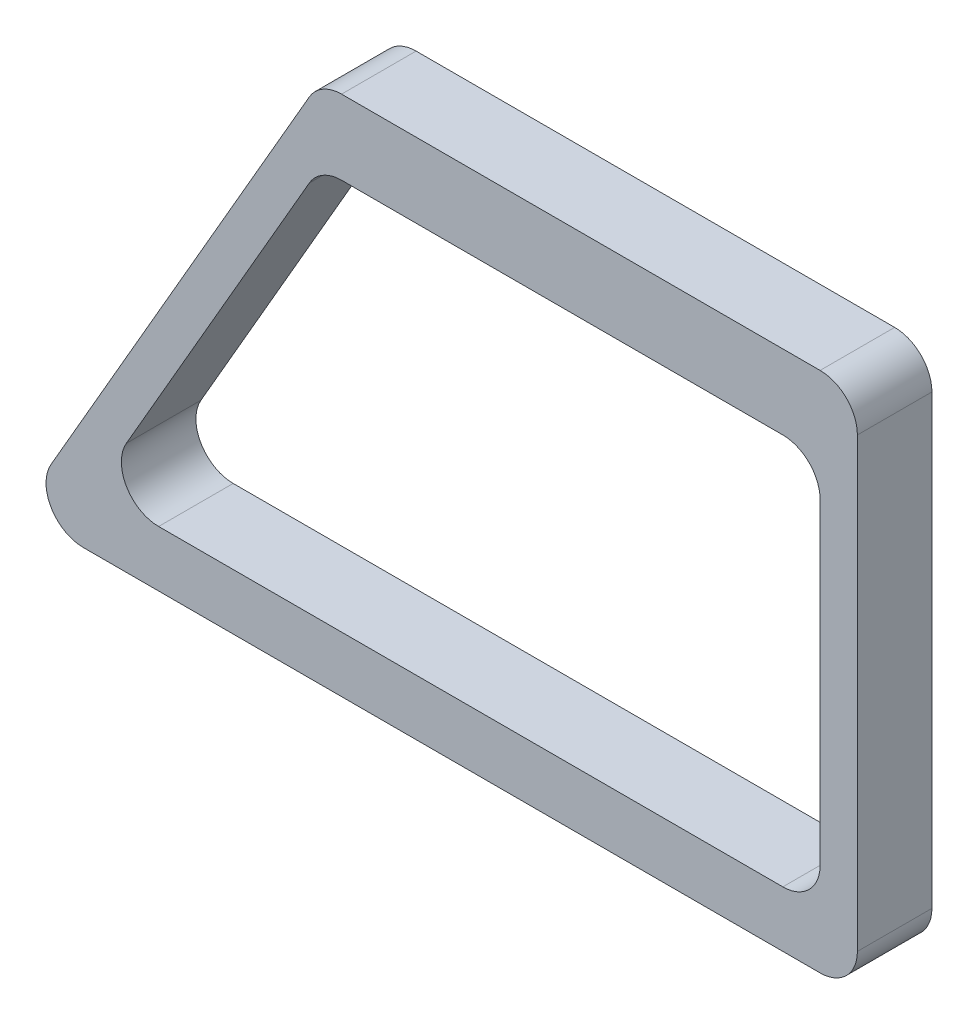
from build123d import *

# Parameters (mm, degrees)
BOSS_EXTRUDE1_DEPTH = 40
SKETCH3_R           = 2.5
CUT_EXTRUDE1_DEPTH  = 10
FILLET3_R           = 20


with BuildPart() as part:
    # Sketch1 → Boss-Extrude1 (new body)
    with BuildSketch(Plane.XY):
        Polygon((125.008360384, 233.626853351), (-36.649714989, -46.373146649), (413.350285011, -46.373146649), (413.350285011, 233.626853351), align=None)
        Polygon((393.350285011, 193.626853351), (393.350285011, -16.373146649), (3.764803854, -16.373146649), (125.008360384, 193.626853351), align=None, mode=Mode.SUBTRACT)
    extrude(amount=BOSS_EXTRUDE1_DEPTH)

    # Sketch3 → Cut-Extrude1 (cut)
    with BuildSketch(Plane(origin=(0, 0, 0), x_dir=(-1, 0, 0), z_dir=(0, 0, -1))):
        with Locations((-180.923528507, 226.126853351)):
            Circle(SKETCH3_R)
        with Locations((-200.923528507, 211.126853351)):
            Circle(SKETCH3_R)
        with Locations((-220.923528507, 226.126853351)):
            Circle(SKETCH3_R)
    cut_extrude1 = extrude(amount=-CUT_EXTRUDE1_DEPTH, mode=Mode.SUBTRACT)

    # Mirror1: Cut-Extrude1 across plane
    add(cut_extrude1.mirror(Plane(origin=(264.955285011, 0, 0), x_dir=(0, 0, 1), z_dir=(1, 0, 0))), mode=Mode.SUBTRACT)

    # Fillet3
    fillet3_edges = [part.edges().sort_by_distance(p)[0] for p in [
        (393.350285011, 193.626853351, 20),
        (125.008360384, 193.626853351, 20),
        (3.764803854, -16.373146649, 20),
        (393.350285011, -16.373146649, 20),
        (-36.649714989, -46.373146649, 20),
        (125.008360384, 233.626853351, 20),
        (413.350285011, 233.626853351, 20),
        (413.350285011, -46.373146649, 20),
    ]]
    fillet(fillet3_edges, radius=FILLET3_R)


solid = part.part
